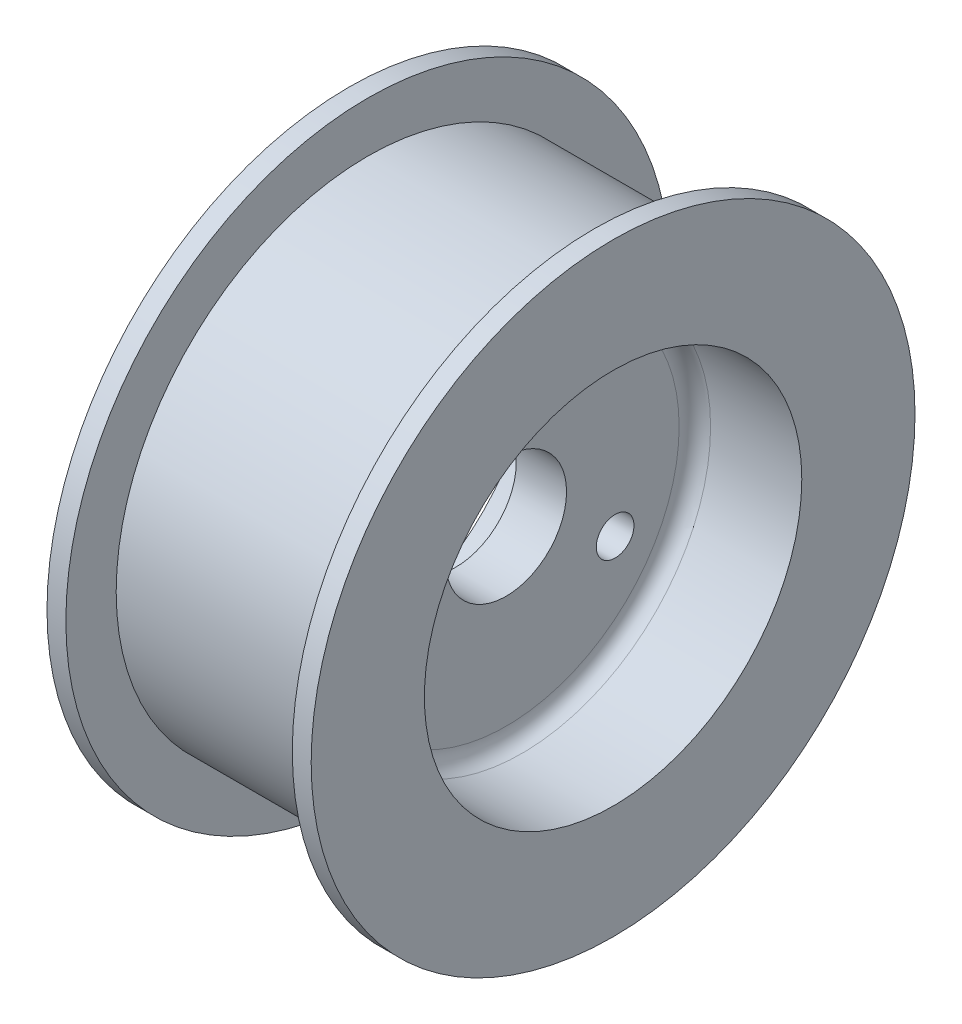
from build123d import *

# Parameters (mm, degrees)
SKETCH1_R           = 15
SKETCH1_R_2         = 4.8
SKETCH1_R_3         = 1.5
BOSS_EXTRUDE1_DEPTH = 2
SKETCH7_W           = 1.5
SKETCH7_H           = 4
FILLET1_R           = 1.25


with BuildPart() as part:
    # Sketch1 → Boss-Extrude1 (new, symmetric)
    with BuildSketch(Plane.YZ):
        with Locations(Location((0, 0, 0), (0, 0, 270))):
            Circle(SKETCH1_R)
        with Locations(Location((0, 0, 0), (0, 0, 270))):
            Circle(SKETCH1_R_2, mode=Mode.SUBTRACT)
        with Locations(Location((10, 0, 0), (0, 0, 270))):
            Circle(SKETCH1_R_3, mode=Mode.SUBTRACT)
        with Locations(Location((-5, -8.660254038, 0), (0, 0, 270))):
            Circle(SKETCH1_R_3, mode=Mode.SUBTRACT)
        with Locations(Location((-5, 8.660254038, 0), (0, 0, 270))):
            Circle(SKETCH1_R_3, mode=Mode.SUBTRACT)
    extrude(amount=BOSS_EXTRUDE1_DEPTH, both=True)

    # Sketch2 → Revolve1 (revolve)
    with BuildSketch(Plane(origin=(0, 0, 0), x_dir=(-1, 0, 0), z_dir=(0, 1, 0)), mode=Mode.PRIVATE) as revolve1_sk:
        Polygon((-2, 15), (-10.5, 15), (-10.5, 20), (10.5, 20), (10.5, 15), (2, 15), align=None)
    revolve(revolve1_sk.sketch.rotate(Axis((2, 0, 0), (-1, 0, 0)), 180), axis=Axis((2, 0, 0), (-1, 0, 0)))

    # Sketch7 → Revolve2 (revolve)
    with BuildSketch(Plane(origin=(0, 0, 0), x_dir=(-1, 0, 0), z_dir=(0, 1, 0)), mode=Mode.PRIVATE) as revolve2_sk:
        with Locations((-9.75, 22)):
            Rectangle(SKETCH7_W, SKETCH7_H)
    revolve2 = revolve(revolve2_sk.sketch.rotate(Axis((2, 0, 0), (-1, 0, 0)), 180), axis=Axis((2, 0, 0), (-1, 0, 0)))

    # Mirror1: Revolve2 across plane
    add(revolve2.mirror(Plane(origin=(0, 0, 0), x_dir=(0, 0, 1), z_dir=(1, 0, 0))))

    # Fillet1
    fillet1_edges = [part.edges().sort_by_distance(p)[0] for p in [
        (-2, 0, 15),
        (2, 0, 15),
    ]]
    fillet(fillet1_edges, radius=FILLET1_R)


solid = part.part
